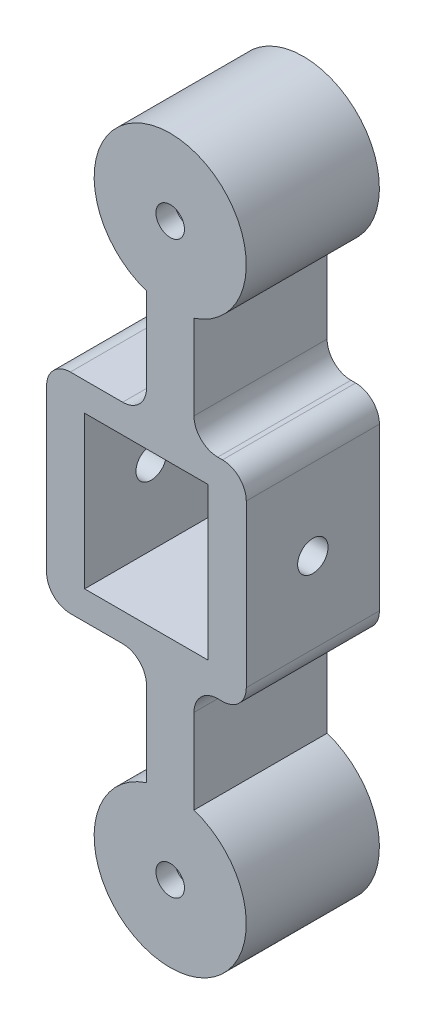
from build123d import *

# Parameters (mm, degrees)
ESBO_O1_R                  = 4
ESBO_O1_W                  = 13
ESBO_O1_H                  = 16
RESSALTO_EXTRUS_O1_DEPTH   = 14
RESSALTO_EXTRUS_O2_START   = -4
ESBO_O3_R                  = 8
ESBO_O3_R_2                = 1.5
RESSALTO_EXTRUS_O2_DEPTH   = 4
CORTE_EXTRUS_O1_DEPTH      = 71.215738976
CORTE_EXTRUS_O1_DEPTH_BACK = 71.215738976
ESBO_O2_R                  = 1.6
CORTE_EXTRUS_O2_START      = 2
CORTE_EXTRUS_O2_DEPTH      = 2
FILETE1_R                  = 2.5


with BuildPart() as part:
    # Esboço1 → Ressalto-extrusão1 (new body)
    with BuildSketch(Plane.XY):
        with BuildLine():
            Line((2.5, 52.400657923), (2.5, 41))
            Line((2.5, 41), (8, 41))
            Line((8, 41), (8, 19))
            Line((8, 19), (2.5, 19))
            Line((2.5, 19), (2.5, 7.599342077))
            ThreePointArc((2.5, 7.599342077), (0, -8), (-2.5, 7.599342077))
            Line((-2.5, 7.599342077), (-2.5, 19))
            Line((-2.5, 19), (-13, 19))
            Line((-13, 19), (-13, 41))
            Line((-13, 41), (-2.5, 41))
            Line((-2.5, 41), (-2.5, 52.400657923))
            ThreePointArc((-2.5, 52.400657923), (0, 68), (2.5, 52.400657923))
        make_face()
        with Locations((0, 60)):
            Circle(ESBO_O1_R, mode=Mode.SUBTRACT)
        Circle(ESBO_O1_R, mode=Mode.SUBTRACT)
        with Locations((-2.5, 30)):
            Rectangle(ESBO_O1_W, ESBO_O1_H, mode=Mode.SUBTRACT)
    extrude(amount=RESSALTO_EXTRUS_O1_DEPTH)

    # Esboço3 → Ressalto-extrusão2 (add)
    # profile 1 of 2: a face of its own
    with BuildSketch(Plane.XY.offset(14).offset(RESSALTO_EXTRUS_O2_START)):
        with Locations((0, 60)):
            Circle(ESBO_O3_R)
        with Locations((0, 60)):
            Circle(ESBO_O3_R_2, mode=Mode.SUBTRACT)
    # profile 2 of 2: a face of its own
    with BuildSketch(Plane.XY.offset(14).offset(RESSALTO_EXTRUS_O2_START)):
        Circle(ESBO_O3_R)
        Circle(ESBO_O3_R_2, mode=Mode.SUBTRACT)
    extrude(amount=RESSALTO_EXTRUS_O2_DEPTH)

    # Esboço2 → Corte-extrusão1 (cut, two sides: drawn at the far end of the back side and taken through both)
    with BuildSketch(Plane.ZY.offset(2.5).offset(-CORTE_EXTRUS_O1_DEPTH_BACK)):
        with Locations(Location((7, 30, 0), (0, 0, 270))):
            Circle(ESBO_O2_R)
    extrude(amount=CORTE_EXTRUS_O1_DEPTH + CORTE_EXTRUS_O1_DEPTH_BACK, mode=Mode.SUBTRACT)

    # Esboço4 → Corte-extrusão2 (cut)
    with BuildSketch(Plane.XY.offset(10).offset(CORTE_EXTRUS_O2_START)):
        Polygon((0, 56.940043573), (2.65, 58.470021787), (2.65, 61.529978213), (0, 63.059956427), (-2.65, 61.529978213), (-2.65, 58.470021787), align=None)
        Polygon((0, -3.059956427), (2.65, -1.529978213), (2.65, 1.529978213), (0, 3.059956427), (-2.65, 1.529978213), (-2.65, -1.529978213), align=None)
    extrude(amount=-CORTE_EXTRUS_O2_DEPTH, mode=Mode.SUBTRACT)

    # Filete1
    filete1_edges = [part.edges().sort_by_distance(p)[0] for p in [
        (-2.5, 19, 7),
        (-13, 19, 7),
        (-13, 41, 7),
        (-2.5, 41, 7),
        (2.5, 41, 7),
        (8, 41, 7),
        (8, 19, 7),
        (2.5, 19, 7),
    ]]
    fillet(filete1_edges, radius=FILETE1_R)


solid = part.part
